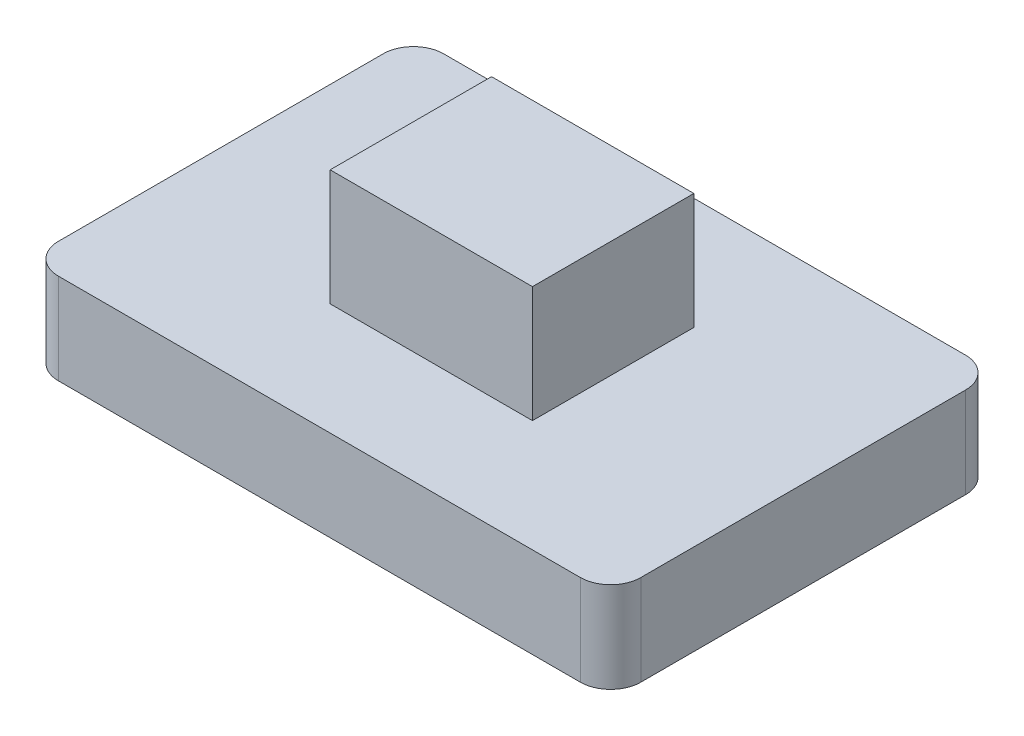
from build123d import *

# Parameters (mm, degrees)
EXTRUDE4_DEPTH = 19.05
SKETCH4_W      = 42.505133665
SKETCH4_H      = 33.908575234
EXTRUDE5_DEPTH = 24.384


with BuildPart() as part:
    # Sketch3 → Extrude4 (new body)
    with BuildSketch(Plane(origin=(0, 0, 0), x_dir=(1, 0, 0), z_dir=(0, 1, 0))):
        with BuildLine():
            Line((6.35, 0), (116.003921001, 0))
            ThreePointArc((116.003921001, 0), (120.494049062, 1.859871939), (122.353921001, 6.35))
            Line((122.353921001, 6.35), (122.353921001, 74.579258312))
            ThreePointArc((122.353921001, 74.579258312), (120.494049062, 79.069386372), (116.003921001, 80.929258312))
            Line((116.003921001, 80.929258312), (6.35, 80.929258312))
            ThreePointArc((6.35, 80.929258312), (1.859871939, 79.069386372), (0, 74.579258312))
            Line((0, 74.579258312), (0, 6.35))
            ThreePointArc((0, 6.35), (1.859871939, 1.859871939), (6.35, 0))
        make_face()
    extrude(amount=-EXTRUDE4_DEPTH)

    # Sketch4 → Extrude5 (add)
    with BuildSketch(Plane(origin=(0, 0, 0), x_dir=(1, 0, 0), z_dir=(0, 1, 0))):
        with Locations((61.176960501, 40.464629156)):
            Rectangle(SKETCH4_W, SKETCH4_H)
    extrude(amount=EXTRUDE5_DEPTH)


solid = part.part
